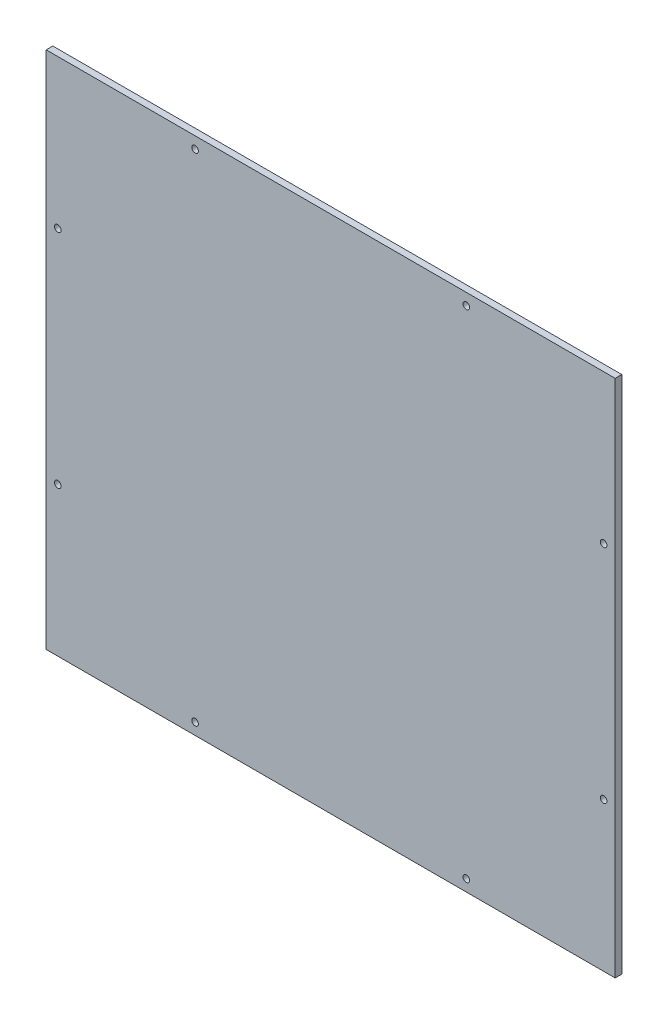
from build123d import *

# Parameters (mm, degrees)
SCHIZZO1_W                   = 344
SCHIZZO1_H                   = 314
SCHIZZO1_R                   = 2
ESTRUSIONE_ESTRUSIONE1_DEPTH = 4


with BuildPart() as part:
    # Schizzo1 → Estrusione-Estrusione1 (new body)
    with BuildSketch(Plane.XY):
        with Locations((-172, 157)):
            Rectangle(SCHIZZO1_W, SCHIZZO1_H)
        with Locations(Location((-90, 307, 0), (0, 0, 180))):
            Circle(SCHIZZO1_R, mode=Mode.SUBTRACT)
        with Locations((-7, 224)):
            Circle(SCHIZZO1_R, mode=Mode.SUBTRACT)
        with Locations((-254, 307)):
            Circle(SCHIZZO1_R, mode=Mode.SUBTRACT)
        with Locations(Location((-337, 224, 0), (0, 0, 180))):
            Circle(SCHIZZO1_R, mode=Mode.SUBTRACT)
        with Locations(Location((-254, 7, 0), (0, 0, 180))):
            Circle(SCHIZZO1_R, mode=Mode.SUBTRACT)
        with Locations((-337, 90)):
            Circle(SCHIZZO1_R, mode=Mode.SUBTRACT)
        with Locations(Location((-7, 90, 0), (0, 0, 180))):
            Circle(SCHIZZO1_R, mode=Mode.SUBTRACT)
        with Locations((-90, 7)):
            Circle(SCHIZZO1_R, mode=Mode.SUBTRACT)
    extrude(amount=ESTRUSIONE_ESTRUSIONE1_DEPTH)


solid = part.part
